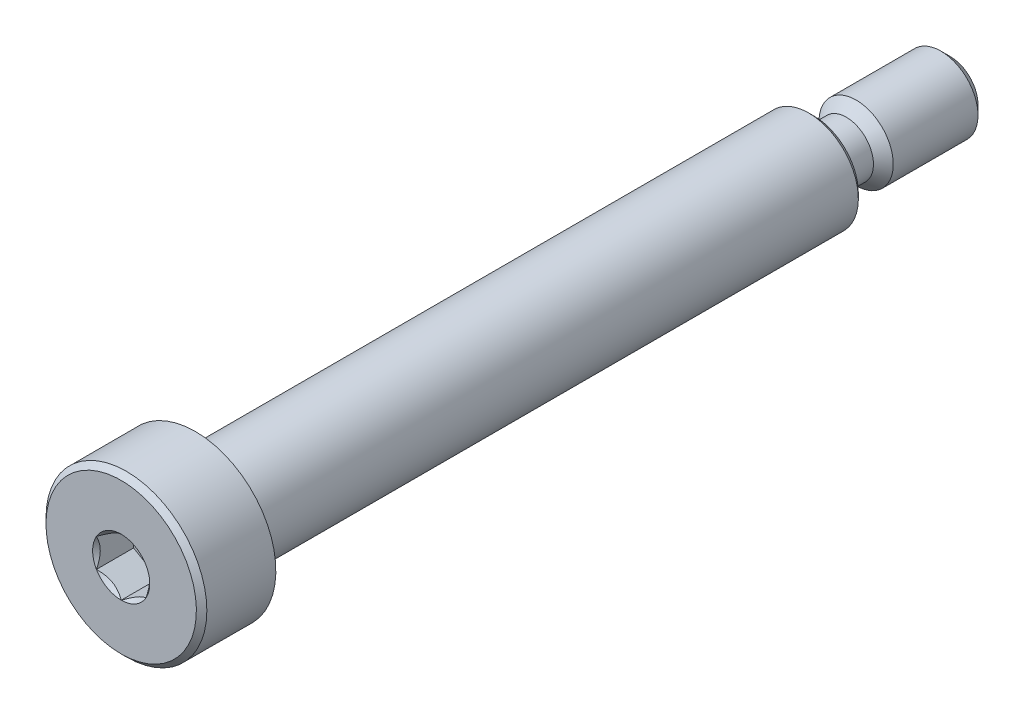
from build123d import *

# Parameters (mm, degrees)
SKETCH12_W         = 0.866666667
SKETCH12_H         = 0.866666667
CHAMFER3_SIZE      = 0.26
CHAMFER1_SIZE      = 0.75
CHAMFER2_SIZE      = 0.4225
CUT_EXTRUDE2_DEPTH = 3


with BuildPart() as part:
    # Sketch1 → Revolve1 (revolve)
    with BuildSketch(Plane(origin=(0, 0, 0), x_dir=(0, 0, -1), z_dir=(1, 0, 0))):
        Polygon((0, 6.5), (6, 6.5), (6, 4), (56, 4), (56, 3), (67, 3), (67, 0), (0, 0), align=None)
    revolve(axis=Axis((0, 0, -67), (0, 0, 1)))

    # Sketch12 → Cut-Revolve2 (revolve, cut)
    with BuildSketch(Plane(origin=(0, 0, 0), x_dir=(0, 0, -1), z_dir=(1, 0, 0))):
        with Locations((6.433333334, 3.566666667)):
            Rectangle(SKETCH12_W, SKETCH12_H)
    revolve(axis=Axis((0, 0, -67), (0, 0, 1)), mode=Mode.SUBTRACT)

    # Chamfer3
    chamfer3_edges = [part.edges().sort_by_distance(p)[0] for p in [
        (0, -4, -6.866666667),
        (0, -3.133333333, -6.866666667),
    ]]
    chamfer(chamfer3_edges, length=CHAMFER3_SIZE)

    # Sketch5 → Cut-Revolve1 (revolve, cut)
    with BuildSketch(Plane(origin=(0, 0, 0), x_dir=(0, 0, -1), z_dir=(1, 0, 0))):
        with BuildLine():
            Line((56, 4), (60.4, 4))
            Line((60.4, 4), (58.6, 2.2))
            Line((58.6, 2.2), (56.8, 2.2))
            ThreePointArc((56.8, 2.2), (56.234314575, 2.434314575), (56, 3))
            Line((56, 3), (56, 4))
        make_face()
    revolve(axis=Axis((0, 0, -67), (0, 0, 1)), mode=Mode.SUBTRACT)

    # Chamfer1
    chamfer1_edges = [part.edges().sort_by_distance(p)[0] for p in [
        (0, -3, -67),
    ]]
    chamfer(chamfer1_edges, length=CHAMFER1_SIZE)

    # Chamfer2
    chamfer2_edges = [part.edges().sort_by_distance(p)[0] for p in [
        (0, -6.5, 0),
        (0, -4, -56),
    ]]
    chamfer(chamfer2_edges, length=CHAMFER2_SIZE)

    # Sketch8 → Cut-Extrude2 (cut)
    with BuildSketch(Plane.XY):
        Polygon((2, 1.154700538), (0, 2.309401077), (-2, 1.154700538), (-2, -1.154700538), (0, -2.309401077), (2, -1.154700538), align=None)
    extrude(amount=-CUT_EXTRUDE2_DEPTH, mode=Mode.SUBTRACT)

    # Cut-Extrude4 cone 1 section (through the dimple's axis) → Cut-Extrude4 (revolve, cut)
    with BuildSketch(Plane(origin=(0, 0, 0), x_dir=(0, -1, 0), z_dir=(1, 0, 0))):
        Polygon((0, 0), (2.309401077, 0), (0, 2.309401077), align=None)
    revolve(axis=Axis((0, 0, 0), (0, 0, -1)), mode=Mode.SUBTRACT)


solid = part.part
